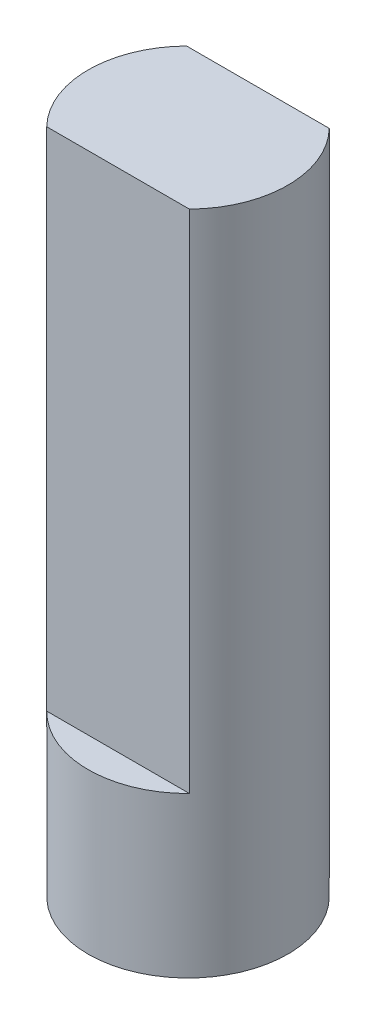
from build123d import *

# Parameters (mm, degrees)
SKETCH_1_R          = 3
EXTRUDE_1_DEPTH     = 20
CUT_EXTRUDE_START   = -15.2
CUT_EXTRUDE_2_DEPTH = 15.2


with BuildPart() as part:
    # 草图1 → 凸台-拉伸1 (new body)
    with BuildSketch(Plane(origin=(0, 0, 0), x_dir=(1, 0, 0), z_dir=(0, 1, 0))):
        with Locations(Location((0, 0, 0), (0, 0, 270))):
            Circle(SKETCH_1_R)
    extrude(amount=EXTRUDE_1_DEPTH)

    # 草图2 → 切除-拉伸2 (cut)
    with BuildSketch(Plane(origin=(0, 20, 0), x_dir=(1, 0, 0), z_dir=(0, 1, 0)).offset(CUT_EXTRUDE_START)):
        with BuildLine():
            Line((-2.142428529, 2.1), (2.142428529, 2.1))
            ThreePointArc((2.142428529, 2.1), (0, 3), (-2.142428529, 2.1))
        make_face()
        with BuildLine():
            Line((-2.142428529, -2.1), (2.142428529, -2.1))
            ThreePointArc((2.142428529, -2.1), (0, -3), (-2.142428529, -2.1))
        make_face()
    extrude(amount=CUT_EXTRUDE_2_DEPTH, mode=Mode.SUBTRACT)


solid = part.part
